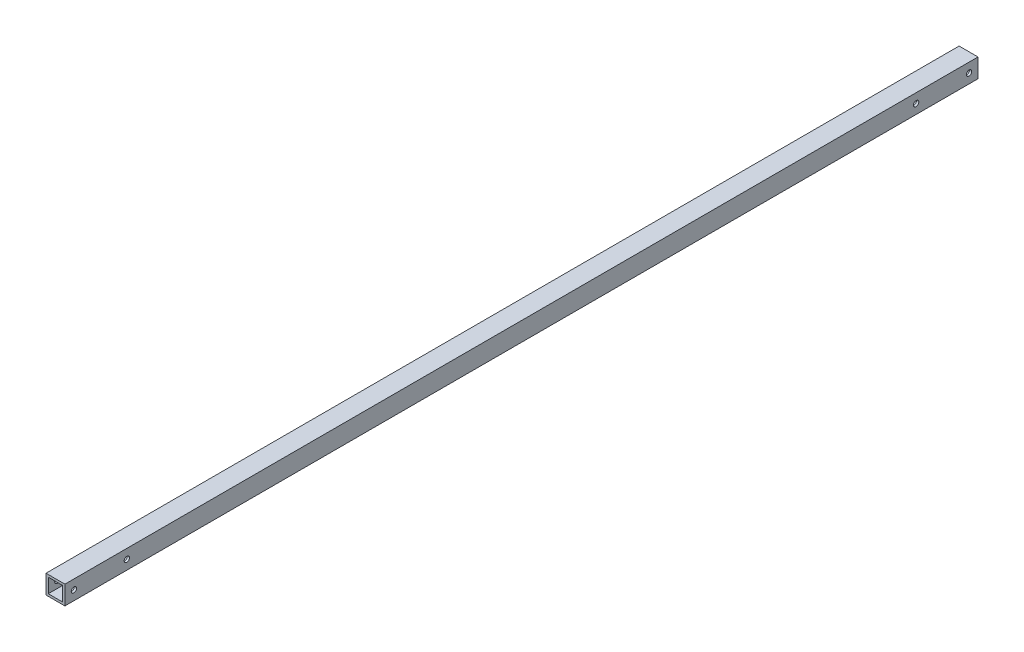
from build123d import *

# Parameters (mm, degrees)
SKETCH_1_W                     = 25
SKETCH_1_H                     = 25
SKETCH_1_W_2                   = 19
SKETCH_1_H_2                   = 19
EXTRUDE_1_DEPTH                = 1207.3
HOLE_WIZARD_7_0_7_1_AT_2_COUNT = 2
HOLE_WIZARD_7_0_7_1_AT_2_PITCH = 70
PATTERN_LINEAR_1_COUNT         = 2
PATTERN_LINEAR_1_PITCH         = 1113.64


with BuildPart() as part:
    # 草图1 → 拉伸1 (new body)
    with BuildSketch(Plane.XY):
        with Locations((12.5, -12.5)):
            Rectangle(SKETCH_1_W, SKETCH_1_H)
        with Locations((12.5, -12.5)):
            Rectangle(SKETCH_1_W_2, SKETCH_1_H_2, mode=Mode.SUBTRACT)
    extrude(amount=EXTRUDE_1_DEPTH)

    # 草图4 → Ø7.0 (7) 直径孔1 (revolve, cut)
    with BuildSketch(Plane(origin=(0, -12.5, 11.8), x_dir=(0, 0, 1), z_dir=(0, 1, 0))):
        Polygon((0, 0), (0, 32.103012167), (3.5, 30), (3.5, 0), align=None)
    hole_wizard_7_0_7_1 = revolve(axis=Axis((-6.35, -12.5, 11.8), (1, 0, 0)), mode=Mode.SUBTRACT)

    # Ø7.0 (7) 直径孔1 at 2: Ø7.0 (7) 直径孔1 ×2
    with Locations(*[(0, 0, i * HOLE_WIZARD_7_0_7_1_AT_2_PITCH) for i in range(1, HOLE_WIZARD_7_0_7_1_AT_2_COUNT)]):
        add(hole_wizard_7_0_7_1, mode=Mode.SUBTRACT)

    # 阵列(线性)1: Ø7.0 (7) 直径孔1 ×2
    with Locations(*[(0, 0, i * PATTERN_LINEAR_1_PITCH) for i in range(1, PATTERN_LINEAR_1_COUNT)]):
        add(hole_wizard_7_0_7_1, mode=Mode.SUBTRACT)

    # 阵列(线性)1 copy 1 sketch → 阵列(线性)1 copy 1 (revolve, cut)
    with BuildSketch(Plane(origin=(0, -12.5, 1195.44), x_dir=(0, 0, 1), z_dir=(0, 1, 0))):
        Polygon((0, 0), (0, 32.103012167), (3.5, 30), (3.5, 0), align=None)
    revolve(axis=Axis((-6.35, -12.5, 1195.44), (1, 0, 0)), mode=Mode.SUBTRACT)


solid = part.part
